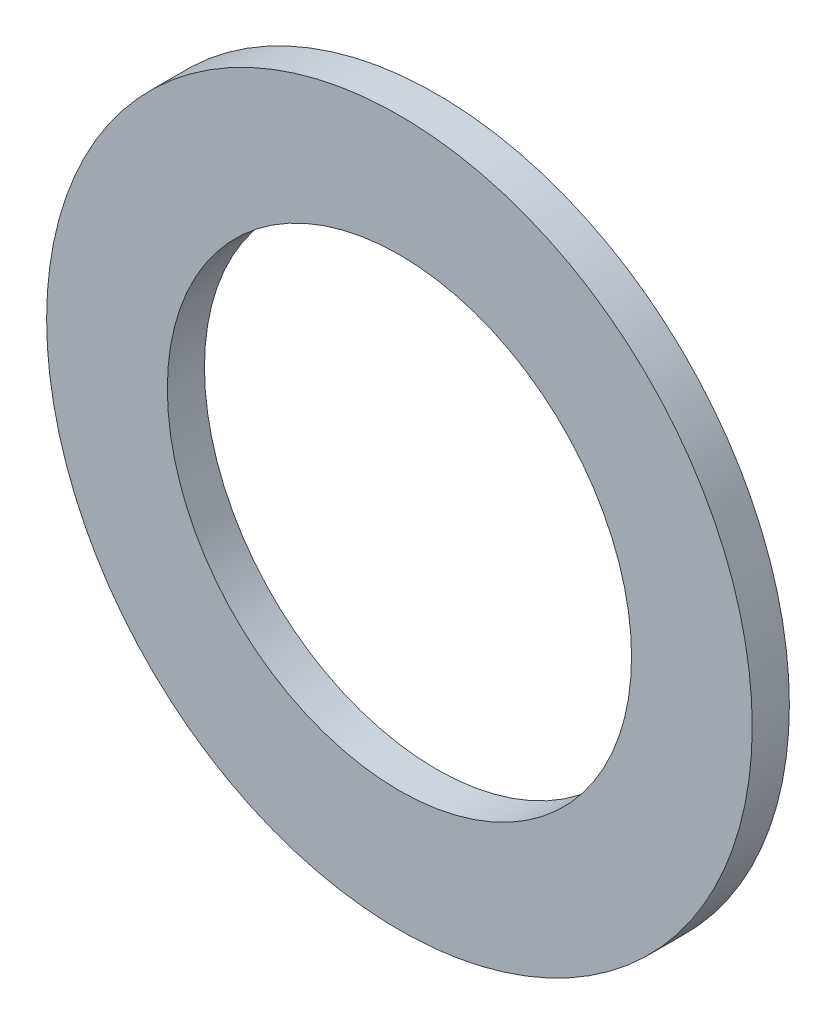
from build123d import *

# Parameters (mm, degrees)
SKETCH1_R      = 4.826
SKETCH1_R_2    = 3.175
EXTRUDE1_DEPTH = 0.508


with BuildPart() as part:
    # Sketch1 → Extrude1 (new body)
    with BuildSketch(Plane.XY):
        Circle(SKETCH1_R)
        Circle(SKETCH1_R_2, mode=Mode.SUBTRACT)
    extrude(amount=-EXTRUDE1_DEPTH)


solid = part.part
